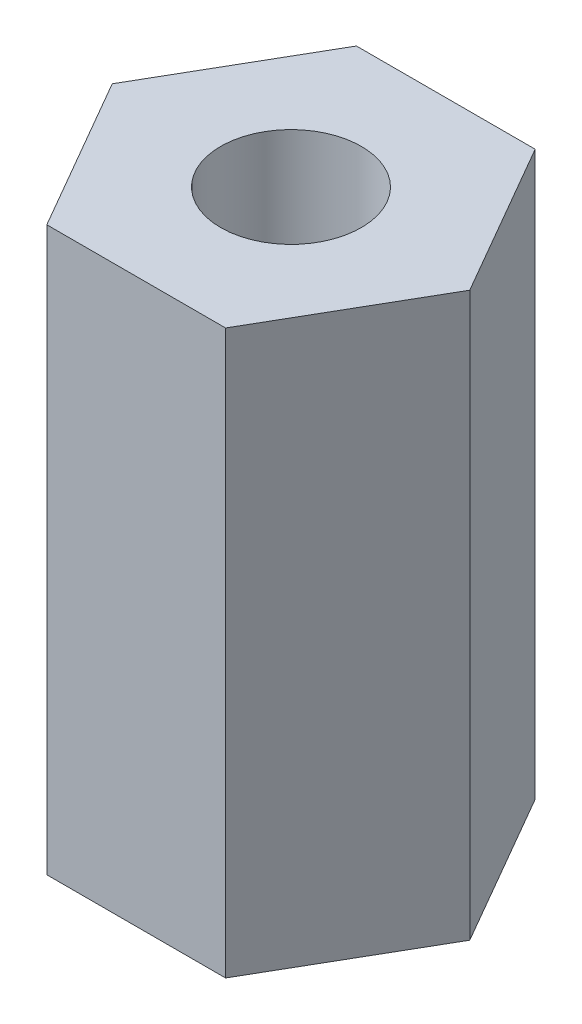
from build123d import *

# Parameters (mm, degrees)
SKETCH1_R           = 1.25
BOSS_EXTRUDE1_DEPTH = 10


with BuildPart() as part:
    # Sketch1 → Boss-Extrude1 (new body)
    with BuildSketch(Plane(origin=(0, 0, 0), x_dir=(1, 0, 0), z_dir=(0, 1, 0))):
        Polygon((3.175426481, 0), (1.58771324, 2.75), (-1.58771324, 2.75), (-3.175426481, 0), (-1.58771324, -2.75), (1.58771324, -2.75), align=None)
        with Locations(Location((0, 0, 0), (0, 0, 270))):
            Circle(SKETCH1_R, mode=Mode.SUBTRACT)
    extrude(amount=BOSS_EXTRUDE1_DEPTH)


solid = part.part
